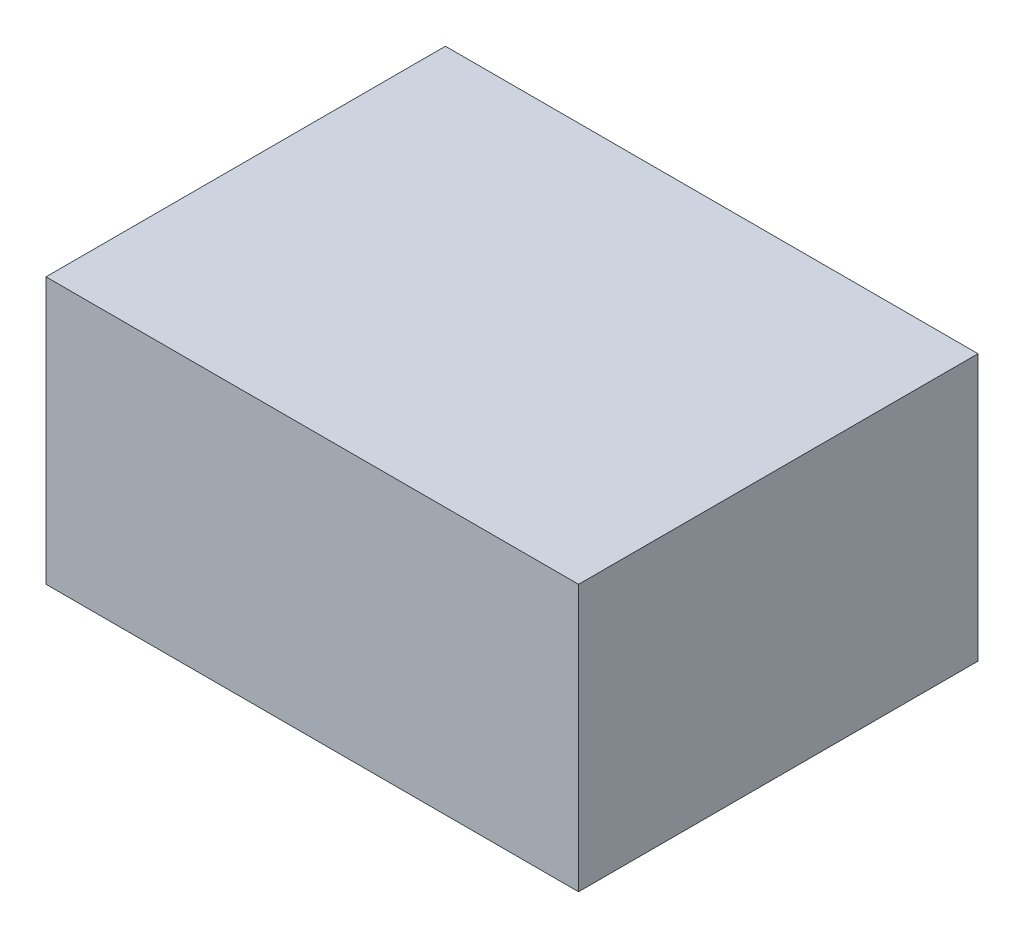
from build123d import *

# Parameters (mm, degrees)
SKETCH1_W           = 60
SKETCH1_H           = 45
BOSS_EXTRUDE1_DEPTH = 30


with BuildPart() as part:
    # Sketch1 → Boss-Extrude1 (new body)
    with BuildSketch(Plane(origin=(0, 0, 0), x_dir=(1, 0, 0), z_dir=(0, 1, 0))):
        with Locations((30, 22.5)):
            Rectangle(SKETCH1_W, SKETCH1_H)
    extrude(amount=BOSS_EXTRUDE1_DEPTH)


solid = part.part
